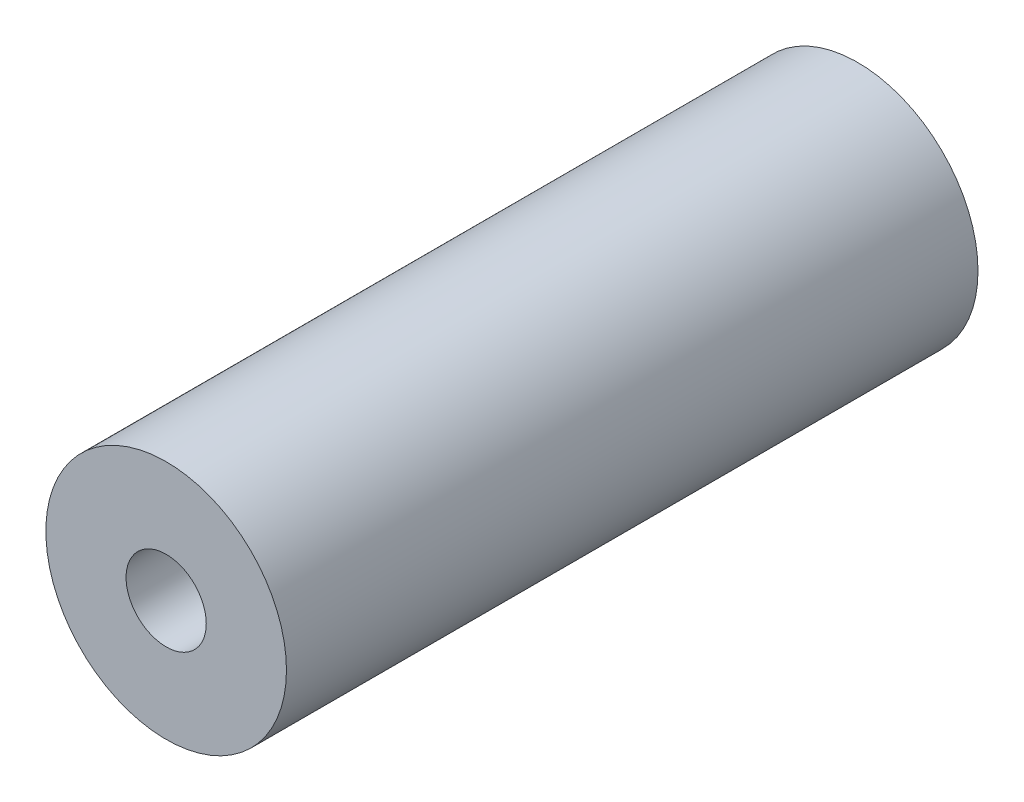
from build123d import *

# Parameters (mm, degrees)
SKETCH1_R           = 19.05
SKETCH1_R_2         = 6.35
BOSS_EXTRUDE1_DEPTH = 54.75


with BuildPart() as part:
    # Sketch1 → Boss-Extrude1 (new, symmetric)
    with BuildSketch(Plane.XY):
        Circle(SKETCH1_R)
        Circle(SKETCH1_R_2, mode=Mode.SUBTRACT)
    extrude(amount=BOSS_EXTRUDE1_DEPTH, both=True)


solid = part.part
